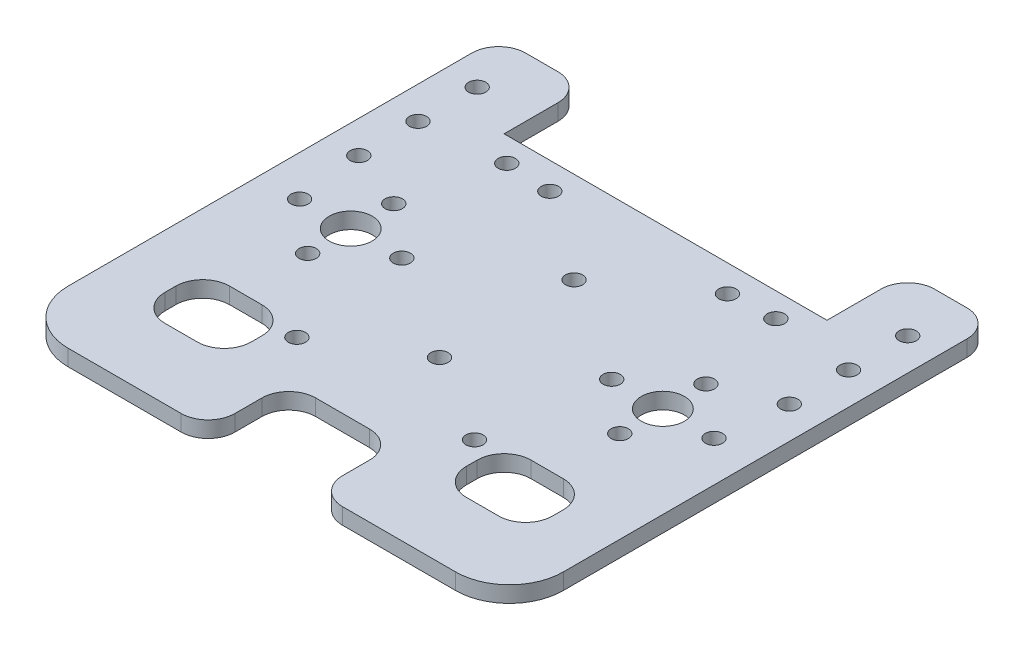
from build123d import *

# Parameters (mm, degrees)
SKETCH_1_R      = 1.6
SKETCH_1_R_2    = 4
EXTRUDE_1_DEPTH = 3


with BuildPart() as part:
    # 草图1 → 凸台-拉伸1 (new body)
    with BuildSketch(Plane(origin=(0, 0, 0), x_dir=(1, 0, 0), z_dir=(0, 1, 0))):
        with BuildLine():
            Line((5, 75), (-5, 75))
            ThreePointArc((-5, 75), (-8.535533906, 73.535533906), (-10, 70))
            Line((-10, 70), (-10, 65))
            ThreePointArc((-10, 65), (-11.464466094, 61.464466094), (-15, 60))
            Line((-15, 60), (-36, 60))
            ThreePointArc((-36, 60), (-43.071067812, 62.928932188), (-46, 70))
            Line((-46, 70), (-46, 145))
            ThreePointArc((-46, 145), (-44.535533906, 148.535533906), (-41, 150))
            Line((-41, 150), (-35, 150))
            ThreePointArc((-35, 150), (-31.464466094, 148.535533906), (-30, 145))
            Line((-30, 145), (-30, 135))
            Line((-30, 135), (30, 135))
            Line((30, 135), (30, 145))
            ThreePointArc((30, 145), (31.464466094, 148.535533906), (35, 150))
            Line((35, 150), (41, 150))
            ThreePointArc((41, 150), (44.535533906, 148.535533906), (46, 145))
            Line((46, 145), (46, 70))
            ThreePointArc((46, 70), (43.071067812, 62.928932188), (36, 60))
            Line((36, 60), (15, 60))
            ThreePointArc((15, 60), (11.464466094, 61.464466094), (10, 65))
            Line((10, 65), (10, 70))
            ThreePointArc((10, 70), (8.535533906, 73.535533906), (5, 75))
        make_face()
        with Locations(Location((-40, 118, 0), (0, 0, 270))):
            Circle(SKETCH_1_R, mode=Mode.SUBTRACT)
        with Locations(Location((40, 129, 0), (0, 0, 270))):
            Circle(SKETCH_1_R, mode=Mode.SUBTRACT)
        with Locations(Location((-40, 129, 0), (0, 0, 270))):
            Circle(SKETCH_1_R, mode=Mode.SUBTRACT)
        with Locations(Location((40, 118, 0), (0, 0, 270))):
            Circle(SKETCH_1_R, mode=Mode.SUBTRACT)
        with Locations(Location((-16.5, 83, 0), (0, 0, 270))):
            Circle(SKETCH_1_R, mode=Mode.SUBTRACT)
        with Locations(Location((16.5, 83, 0), (0, 0, 270))):
            Circle(SKETCH_1_R, mode=Mode.SUBTRACT)
        with Locations(Location((-25, 130.5, 0), (0, 0, 270))):
            Circle(SKETCH_1_R, mode=Mode.SUBTRACT)
        with Locations(Location((25, 130.5, 0), (0, 0, 270))):
            Circle(SKETCH_1_R, mode=Mode.SUBTRACT)
        with Locations(Location((-16.5, 130, 0), (0, 0, 270))):
            Circle(SKETCH_1_R, mode=Mode.SUBTRACT)
        with Locations(Location((16.5, 130, 0), (0, 0, 270))):
            Circle(SKETCH_1_R, mode=Mode.SUBTRACT)
        with Locations(Location((0, 118, 0), (0, 0, 270))):
            Circle(SKETCH_1_R, mode=Mode.SUBTRACT)
        with Locations(Location((0, 93, 0), (0, 0, 270))):
            Circle(SKETCH_1_R, mode=Mode.SUBTRACT)
        with Locations(Location((-29, 105.5, 0), (0, 0, 270))):
            Circle(SKETCH_1_R_2, mode=Mode.SUBTRACT)
        with Locations(Location((-29, 97.5, 0), (0, 0, 270))):
            Circle(SKETCH_1_R, mode=Mode.SUBTRACT)
        with Locations(Location((-29, 113.5, 0), (0, 0, 270))):
            Circle(SKETCH_1_R, mode=Mode.SUBTRACT)
        with Locations(Location((-19.5, 105.5, 0), (0, 0, 270))):
            Circle(SKETCH_1_R, mode=Mode.SUBTRACT)
        with Locations(Location((-38.5, 105.5, 0), (0, 0, 270))):
            Circle(SKETCH_1_R, mode=Mode.SUBTRACT)
        with Locations(Location((38.5, 105.5, 0), (0, 0, 270))):
            Circle(SKETCH_1_R, mode=Mode.SUBTRACT)
        with Locations(Location((19.5, 105.5, 0), (0, 0, 270))):
            Circle(SKETCH_1_R, mode=Mode.SUBTRACT)
        with Locations(Location((29, 113.5, 0), (0, 0, 270))):
            Circle(SKETCH_1_R, mode=Mode.SUBTRACT)
        with Locations(Location((29, 97.5, 0), (0, 0, 270))):
            Circle(SKETCH_1_R, mode=Mode.SUBTRACT)
        with Locations(Location((29, 105.5, 0), (0, 0, 270))):
            Circle(SKETCH_1_R_2, mode=Mode.SUBTRACT)
        with Locations(Location((40, 140, 0), (0, 0, 270))):
            Circle(SKETCH_1_R, mode=Mode.SUBTRACT)
        with Locations(Location((-40, 140, 0), (0, 0, 270))):
            Circle(SKETCH_1_R, mode=Mode.SUBTRACT)
        with BuildLine():
            Line((36, 78), (36, 80))
            ThreePointArc((36, 80), (34.535533906, 83.535533906), (31, 85))
            Line((31, 85), (25, 85))
            ThreePointArc((25, 85), (21.464466094, 83.535533906), (20, 80))
            Line((20, 80), (20, 78))
            ThreePointArc((20, 78), (21.464466094, 74.464466094), (25, 73))
            Line((25, 73), (31, 73))
            ThreePointArc((31, 73), (34.535533906, 74.464466094), (36, 78))
        make_face(mode=Mode.SUBTRACT)
        with BuildLine():
            Line((-25, 85), (-31, 85))
            ThreePointArc((-31, 85), (-34.535533906, 83.535533906), (-36, 80))
            Line((-36, 80), (-36, 78))
            ThreePointArc((-36, 78), (-34.535533906, 74.464466094), (-31, 73))
            Line((-31, 73), (-25, 73))
            ThreePointArc((-25, 73), (-21.464466094, 74.464466094), (-20, 78))
            Line((-20, 78), (-20, 80))
            ThreePointArc((-20, 80), (-21.464466094, 83.535533906), (-25, 85))
        make_face(mode=Mode.SUBTRACT)
    extrude(amount=EXTRUDE_1_DEPTH)


solid = part.part
